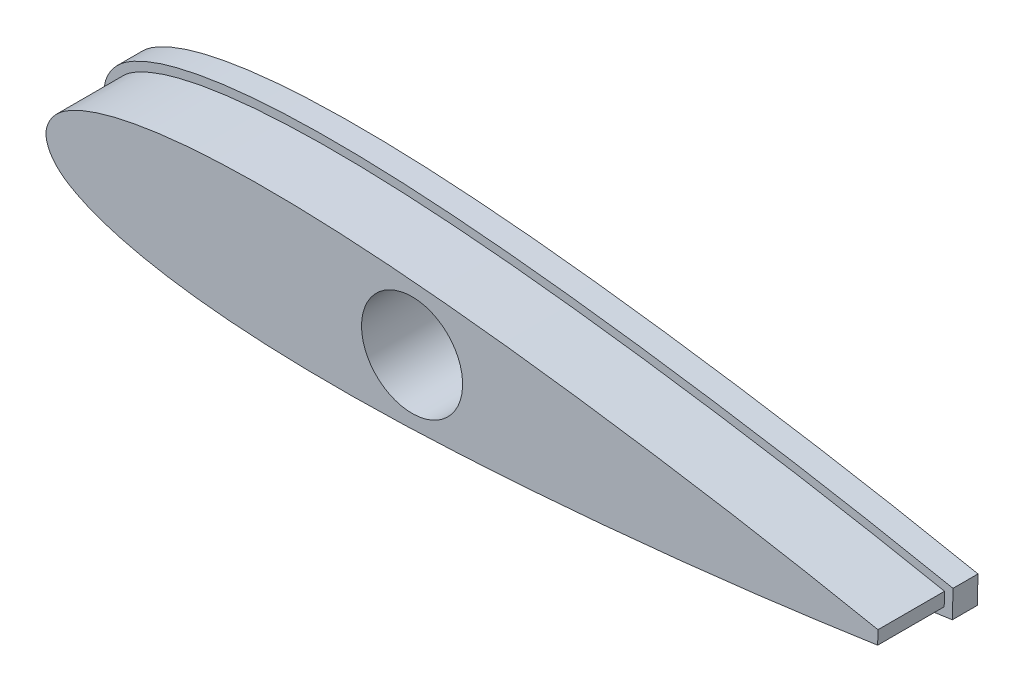
from build123d import *

# Parameters (mm, degrees)
SALIENTE_EXTRUIR1_DEPTH = 8
SALIENTE_EXTRUIR2_DEPTH = 3
CROQUIS4_R              = 6.075
CORTAR_EXTRUIR1_DEPTH   = 30


with BuildPart() as part:
    # Croquis2 → Saliente-Extruir1 (new body)
    with BuildSketch(Plane.XY):
        with BuildLine():
            Line((49.997902668, -2.572402407), (50.039135196, -0.93465046))
            add(Edge.make_bspline(
                [(50.039135196, -0.93465046), (45.873565423, -0.109554209), (37.532476699, 1.491497786), (24.961965907, 3.576223778), (12.352874071, 5.412566214), (-0.303978478, 6.933255356), (-10.90058455, 7.837907896), (-19.410170071, 8.207601313), (-25.806262567, 8.256403228), (-31.14355814, 8.037322631), (-35.408761523, 7.638442665), (-38.602652751, 7.193026082), (-41.775299596, 6.555101147), (-44.396914182, 5.797313734), (-46.449741614, 4.912186471), (-47.918996976, 4.112226748), (-49.361861936, 2.801044964), (-50.239851823, 0.770607996), (-49.465147254, -1.301437697), (-48.090089824, -2.68356433), (-46.662950376, -3.556444546), (-44.657263869, -4.543750158), (-42.077102967, -5.43249901), (-38.94057634, -6.229265565), (-35.77314509, -6.834836686), (-31.533417162, -7.447839322), (-26.213907638, -7.935218799), (-19.823462533, -8.208334541), (-11.30605448, -8.267317756), (-0.677350383, -7.89703991), (12.039989479, -7.015178949), (24.725513028, -5.81566124), (37.385003247, -4.366133225), (45.79609079, -3.18683898), (49.997902668, -2.572402407)],
                knots=[-0.003280902, -0.003280902, -0.003280902, -0.003280902, 0.059629211, 0.122539324, 0.185449436, 0.248359549, 0.311269662, 0.342724718, 0.374179775, 0.405634831, 0.421362359, 0.437089887, 0.452817415, 0.468544944, 0.476408708, 0.484272472, 0.492136236, 0.5, 0.507863764, 0.515727528, 0.523591292, 0.531455056, 0.547182585, 0.562910113, 0.578637641, 0.594365169, 0.625820225, 0.657275282, 0.688730338, 0.751640451, 0.814550564, 0.877460676, 0.940370789, 1.003280902, 1.003280902, 1.003280902, 1.003280902], degree=3))
        make_face()
    extrude(amount=SALIENTE_EXTRUIR1_DEPTH)

    # Croquis3 → Saliente-Extruir2 (add)
    with BuildSketch(Plane.XY):
        with BuildLine():
            Line((50.976377807, -3.439953926), (51.060026513, -0.117435583))
            add(Edge.make_bspline(
                [(51.060026513, -0.117435583), (46.854426604, 0.715589647), (38.438080728, 2.34679184), (25.740415369, 4.467608264), (15.131412877, 6.022910717), (6.614947622, 7.109588351), (0.212117257, 7.830202308), (-6.209292317, 8.441914582), (-12.652072704, 8.910479806), (-19.117337496, 9.200630053), (-24.525309082, 9.250394732), (-28.864439707, 9.132291912), (-32.124031634, 8.947179238), (-35.388248148, 8.64789393), (-38.660685466, 8.198237213), (-41.382429956, 7.656882706), (-43.564481579, 7.08024041), (-45.215412991, 6.531482426), (-46.835784162, 5.836746504), (-48.458099846, 4.96853991), (-49.89086144, 3.684048734), (-50.737060522, 2.179941844), (-51.060026513, 0.791256957), (-50.807349275, -0.611920495), (-50.03790994, -2.156703176), (-48.671599986, -3.511664606), (-47.095028356, -4.460407335), (-45.511669611, -5.235801309), (-43.89044363, -5.866940097), (-41.740173464, -6.552654209), (-39.049118459, -7.230282959), (-35.803453994, -7.844041336), (-32.558433124, -8.307205132), (-29.312285736, -8.656108225), (-24.984595324, -8.992409499), (-19.580970842, -9.214840764), (-13.109296259, -9.250394732), (-6.65109963, -9.106628326), (-0.207043479, -8.818820827), (6.223937008, -8.421314692), (14.784295225, -7.764568222), (25.458121194, -6.74508856), (38.246420983, -5.265914342), (46.734187515, -4.060295088), (50.976377807, -3.439953926)],
                knots=[-0.007442072, -0.007442072, -0.007442072, -0.007442072, 0.055988187, 0.119418446, 0.182848705, 0.214563835, 0.246278964, 0.277994094, 0.309709223, 0.341424353, 0.373139482, 0.388997047, 0.404854612, 0.420712176, 0.436569741, 0.452427306, 0.460356088, 0.468284871, 0.476213653, 0.484142435, 0.492071218, 0.496035609, 0.5, 0.503964391, 0.507928782, 0.515857565, 0.523786347, 0.531715129, 0.539643912, 0.547572694, 0.563430259, 0.579287824, 0.595145388, 0.611002953, 0.626860518, 0.658575647, 0.690290777, 0.722005906, 0.753721036, 0.785436165, 0.817151295, 0.880581554, 0.944011813, 1.007442072, 1.007442072, 1.007442072, 1.007442072], degree=3))
        make_face()
    extrude(amount=-SALIENTE_EXTRUIR2_DEPTH)

    # Croquis4 → Cortar-Extruir1 (cut)
    with BuildSketch(Plane(origin=(0, 0, -3), x_dir=(-1, 0, 0), z_dir=(0, 0, -1))):
        with Locations((5.964085975, -0.344091795)):
            Circle(CROQUIS4_R)
    extrude(amount=-CORTAR_EXTRUIR1_DEPTH, mode=Mode.SUBTRACT)


solid = part.part
